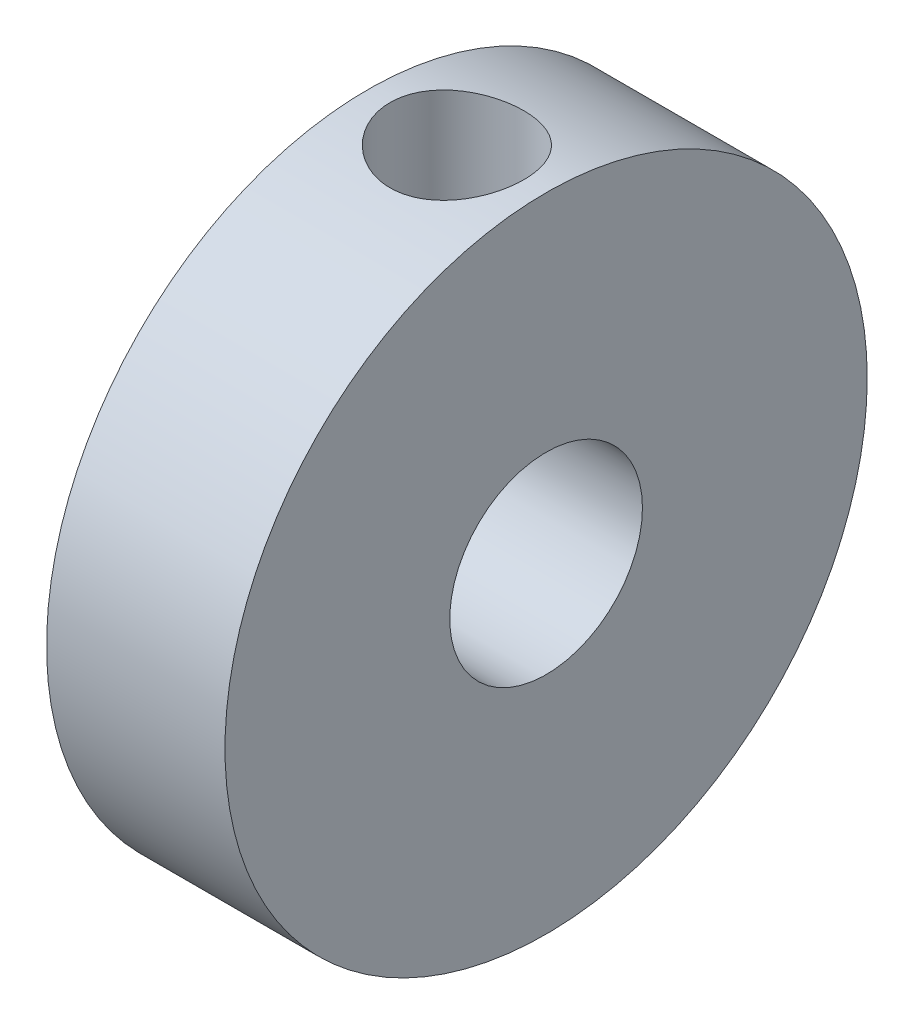
from build123d import *

# Parameters (mm, degrees)
SKETCH1_R           = 11.43
SKETCH1_R_2         = 3.429
BOSS_EXTRUDE1_DEPTH = 6.35
CUT_EXTRUDE1_DEPTH  = 14.986


with BuildPart() as part:
    # Sketch1 → Boss-Extrude1 (new body)
    with BuildSketch(Plane(origin=(0, 0, 0), x_dir=(0, 0, -1), z_dir=(1, 0, 0))):
        Circle(SKETCH1_R)
        Circle(SKETCH1_R_2, mode=Mode.SUBTRACT)
    extrude(amount=BOSS_EXTRUDE1_DEPTH)

    # Sketch2 → Cut-Extrude1 (cut)
    with BuildSketch(Plane(origin=(0, 0, 0), x_dir=(1, 0, 0), z_dir=(0, 1, 0))):
        with BuildLine():
            ThreePointArc((5.55625, 0), (5.070783, 1.440957453), (3.812326951, 2.294377022))
            Line((3.812326951, 2.294377022), (3.175, 0))
            Line((3.175, 0), (3.812326951, -2.294377022))
            ThreePointArc((3.812326951, -2.294377022), (5.070783, -1.440957453), (5.55625, 0))
        make_face()
        with BuildLine():
            Line((3.175, 0), (3.812326951, 2.294377022))
            ThreePointArc((3.812326951, 2.294377022), (3.175, 2.38125), (2.537673049, 2.294377022))
            Line((2.537673049, 2.294377022), (3.175, 0))
        make_face()
        with BuildLine():
            Line((3.812326951, -2.294377022), (3.175, 0))
            Line((3.175, 0), (2.537673049, -2.294377022))
            ThreePointArc((2.537673049, -2.294377022), (3.175, -2.38125), (3.812326951, -2.294377022))
        make_face()
        with BuildLine():
            Line((2.537673049, -2.294377022), (3.175, 0))
            Line((3.175, 0), (2.537673049, 2.294377022))
            ThreePointArc((2.537673049, 2.294377022), (0.79375, 0), (2.537673049, -2.294377022))
        make_face()
    extrude(amount=CUT_EXTRUDE1_DEPTH, mode=Mode.SUBTRACT)


solid = part.part
